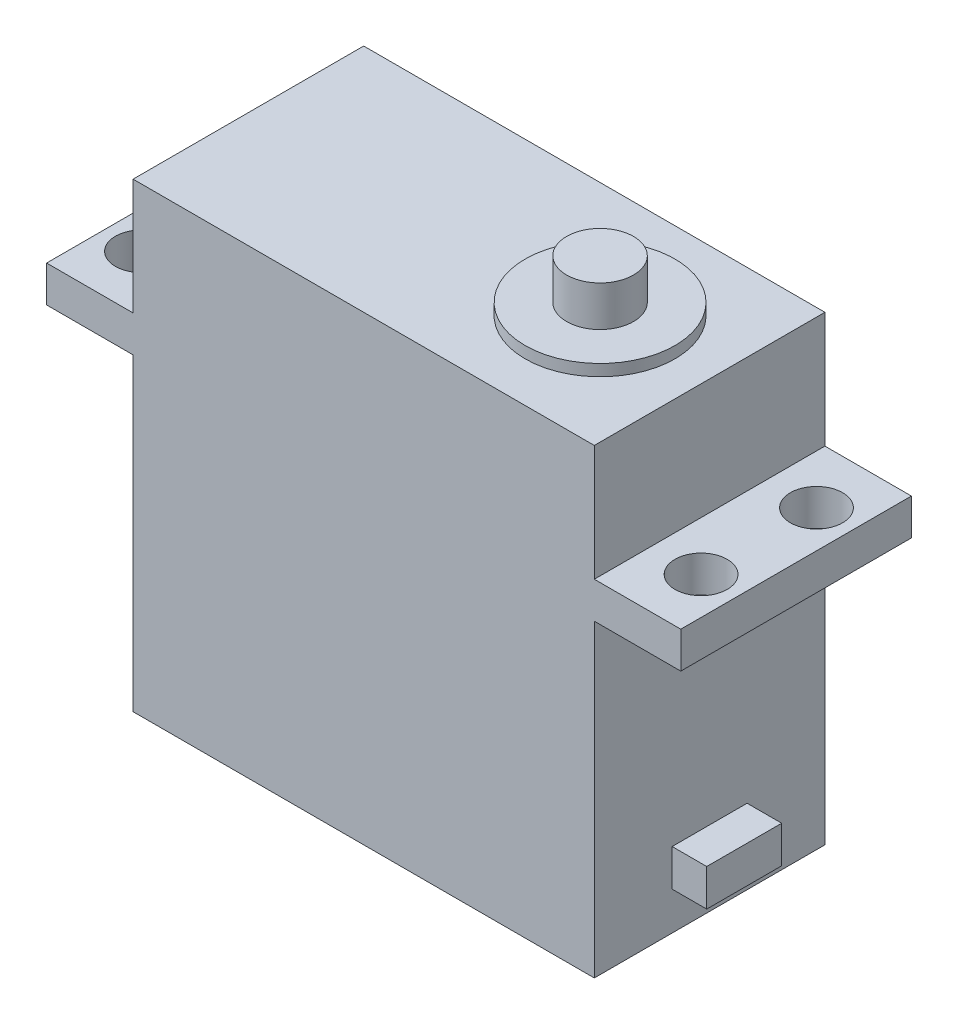
from build123d import *

# Parameters (mm, degrees)
SKETCH1_W               = 40
SKETCH1_H               = 20
BOSS_EXTRUDE1_DEPTH     = 40
BOSS_EXTRUDE2_START     = -13.2
SKETCH2_W               = 55
SKETCH2_H               = 20
BOSS_EXTRUDE2_DEPTH     = 3.15
CUT_EXTRUDE1_DEPTH      = 42.871858091
CUT_EXTRUDE1_DEPTH_BACK = 42.871858091
SKETCH4_R               = 2.265
SKETCH5_R               = 6.5
BOSS_EXTRUDE3_DEPTH     = 1
SKETCH7_R               = 2.9
BOSS_EXTRUDE4_DEPTH     = 3.5
SKETCH8_W               = 6.5
SKETCH8_H               = 3.2
BOSS_EXTRUDE5_DEPTH     = 3


with BuildPart() as part:
    # Sketch1 → Boss-Extrude1 (new body)
    with BuildSketch(Plane(origin=(0, 0, 0), x_dir=(1, 0, 0), z_dir=(0, 1, 0))):
        Rectangle(SKETCH1_W, SKETCH1_H)
    extrude(amount=BOSS_EXTRUDE1_DEPTH)

    # Sketch2 → Boss-Extrude2 (add)
    with BuildSketch(Plane(origin=(0, 40, 0), x_dir=(1, 0, 0), z_dir=(0, 1, 0)).offset(BOSS_EXTRUDE2_START)):
        Rectangle(SKETCH2_W, SKETCH2_H)
    extrude(amount=BOSS_EXTRUDE2_DEPTH)

    # Sketch4 → Cut-Extrude1 (cut, two sides: drawn at the far end of the back side and taken through both)
    with BuildSketch(Plane(origin=(0, 29.95, 0), x_dir=(1, 0, 0), z_dir=(0, 1, 0)).offset(-CUT_EXTRUDE1_DEPTH_BACK)):
        with Locations(Location((-24.265, 5.005, 0), (0, 0, 270))):
            Circle(SKETCH4_R)
        with Locations(Location((-24.265, -5.005, 0), (0, 0, 270))):
            Circle(SKETCH4_R)
        with Locations(Location((24.265, -5.005, 0), (0, 0, 270))):
            Circle(SKETCH4_R)
        with Locations(Location((24.265, 5.005, 0), (0, 0, 270))):
            Circle(SKETCH4_R)
    extrude(amount=CUT_EXTRUDE1_DEPTH + CUT_EXTRUDE1_DEPTH_BACK, mode=Mode.SUBTRACT)

    # Sketch5 → Boss-Extrude3 (add)
    with BuildSketch(Plane(origin=(0, 40, 0), x_dir=(1, 0, 0), z_dir=(0, 1, 0))):
        with Locations(Location((10.5, 0, 0), (0, 0, 270))):
            Circle(SKETCH5_R)
    extrude(amount=BOSS_EXTRUDE3_DEPTH)

    # Sketch7 → Boss-Extrude4 (add)
    with BuildSketch(Plane(origin=(0, 41, 0), x_dir=(1, 0, 0), z_dir=(0, 1, 0))):
        with Locations(Location((10.5, 0, 0), (0, 0, 270))):
            Circle(SKETCH7_R)
    extrude(amount=BOSS_EXTRUDE4_DEPTH)

    # Sketch8 → Boss-Extrude5 (add)
    with BuildSketch(Plane(origin=(20, 0, 0), x_dir=(0, 0, -1), z_dir=(1, 0, 0))):
        with Locations((0, 4.9)):
            Rectangle(SKETCH8_W, SKETCH8_H)
    extrude(amount=BOSS_EXTRUDE5_DEPTH)


solid = part.part
